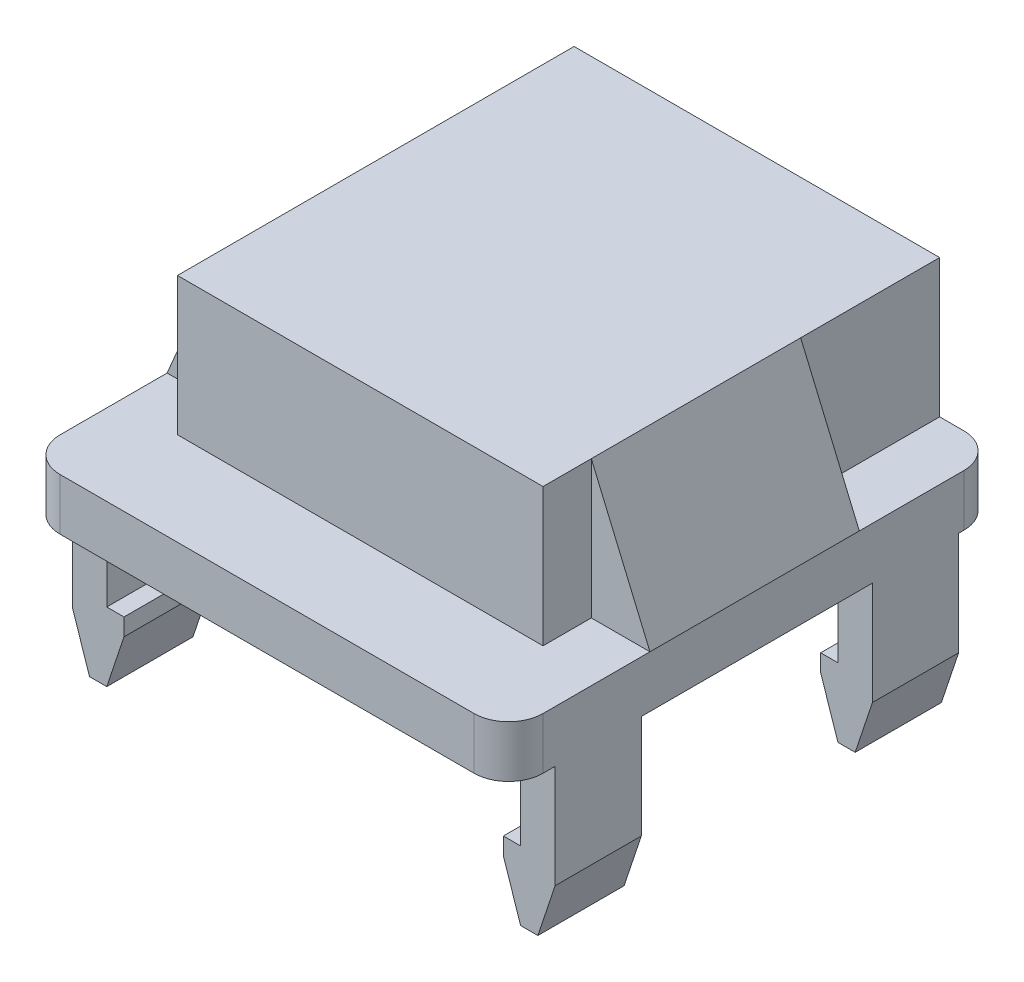
from build123d import *

# Parameters (mm, degrees)
BOSS_EXTRUDE1_DEPTH = 1.5
SKETCH2_W           = 10.6
SKETCH2_H           = 11.5
BOSS_EXTRUDE2_DEPTH = 4
BOSS_EXTRUDE4_DEPTH = 6.07
SKETCH5_W           = 1.5
SKETCH5_H           = 2.5
BOSS_EXTRUDE5_DEPTH = 4.5
SKETCH6_W           = 0.5
SKETCH6_H           = 2.5
CUT_EXTRUDE1_DEPTH  = 16.632418239


with BuildPart() as part:
    # Sketch1 → Boss-Extrude1 (new body)
    with BuildSketch(Plane(origin=(0, 0, 0), x_dir=(1, 0, 0), z_dir=(0, 1, 0))):
        with BuildLine():
            Line((-6, -7.1), (6, -7.1))
            ThreePointArc((6, -7.1), (6.707106781, -6.807106781), (7, -6.1))
            Line((7, -6.1), (7, 6.1))
            ThreePointArc((7, 6.1), (6.707106781, 6.807106781), (6, 7.1))
            Line((6, 7.1), (-6, 7.1))
            ThreePointArc((-6, 7.1), (-6.707106781, 6.807106781), (-7, 6.1))
            Line((-7, 6.1), (-7, -6.1))
            ThreePointArc((-7, -6.1), (-6.707106781, -6.807106781), (-6, -7.1))
        make_face()
    extrude(amount=BOSS_EXTRUDE1_DEPTH)

    # Sketch2 → Boss-Extrude2 (add)
    with BuildSketch(Plane(origin=(0, 1.5, 0), x_dir=(1, 0, 0), z_dir=(0, 1, 0))):
        with Locations((0, 1.35)):
            Rectangle(SKETCH2_W, SKETCH2_H)
    extrude(amount=BOSS_EXTRUDE2_DEPTH)

    # Sketch4 → Boss-Extrude4 (add)
    with BuildSketch(Plane.XY.offset(3)):
        Polygon((-5.3, 5.5), (-7, 1.5), (-5.3, 1.5), align=None)
        Polygon((5.3, 5.5), (7, 1.5), (5.3, 1.5), align=None)
    extrude(amount=-BOSS_EXTRUDE4_DEPTH)

    # Sketch5 → Boss-Extrude5 (add)
    with BuildSketch(Plane.XZ):
        with Locations((-6.25, 4.5)):
            Rectangle(SKETCH5_W, SKETCH5_H)
        with Locations((-6.25, -4.7)):
            Rectangle(SKETCH5_W, SKETCH5_H)
        with Locations((6.25, -4.7)):
            Rectangle(SKETCH5_W, SKETCH5_H)
        with Locations((6.25, 4.5)):
            Rectangle(SKETCH5_W, SKETCH5_H)
    extrude(amount=BOSS_EXTRUDE5_DEPTH)

    # Sketch6 → Cut-Extrude1 (cut, through all)
    with BuildSketch(Plane.XY.offset(5.75)):
        with Locations((-5.75, -1.25)):
            Rectangle(SKETCH6_W, SKETCH6_H)
        Polygon((-7, -4.5), (-7, -3), (-6.5, -4.5), align=None)
        Polygon((-5.5, -3), (-6, -4.5), (-5.5, -4.5), align=None)
        with Locations((5.75, -1.25)):
            Rectangle(SKETCH6_W, SKETCH6_H)
        Polygon((5.5, -3), (6, -4.5), (5.5, -4.5), align=None)
        Polygon((7, -4.5), (7, -3), (6.5, -4.5), align=None)
    extrude(amount=-CUT_EXTRUDE1_DEPTH, mode=Mode.SUBTRACT)


solid = part.part
